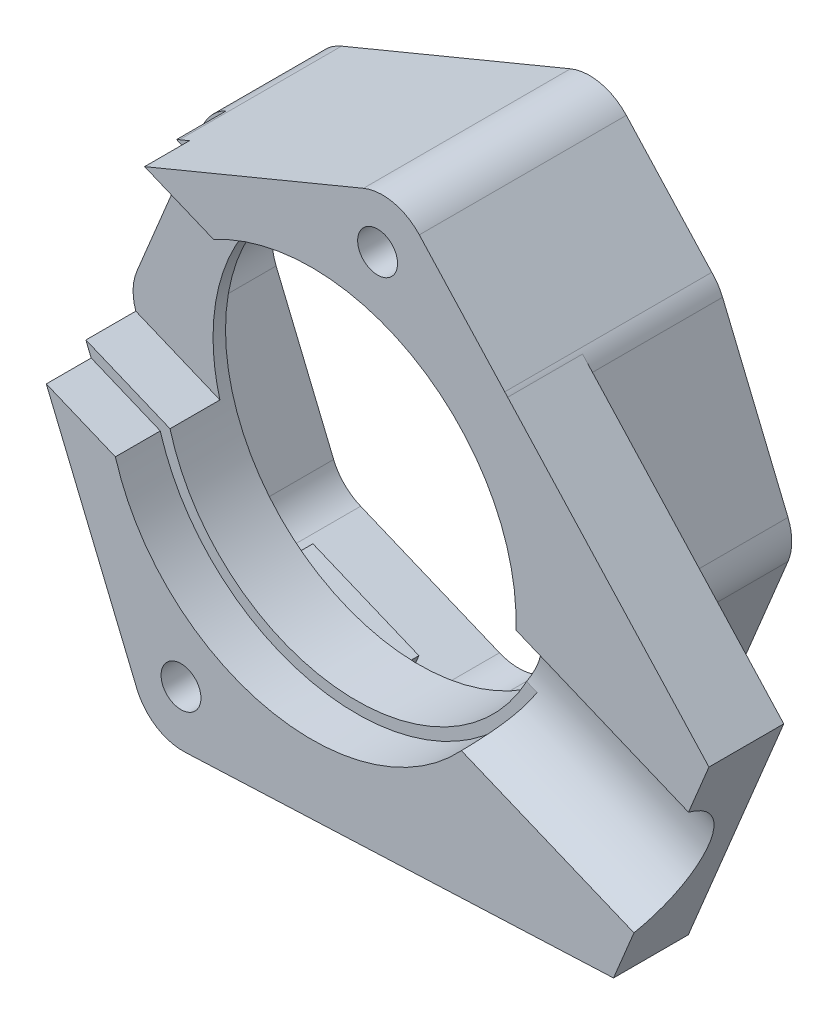
from build123d import *

# Parameters (mm, degrees)
BOSS_EXTRUDE1_DEPTH             = 6
BOSS_EXTRUDE1_2_DEPTH           = 6
CUT_EXTRUDE1_DEPTH              = 4
BOSS_EXTRUDE2_DEPTH             = 0.5
BOSS_EXTRUDE2_DEPTH_BACK        = 2
BOSS_EXTRUDE3_REACH             = 22.017
BOSS_EXTRUDE3_START             = -3
SKETCH6_R                       = 7.75
CUT_EXTRUDE2_DEPTH              = 17.227295759
FILLET1_R                       = 2
BOSS_EXTRUDE4_START             = 1.8
BOSS_EXTRUDE4_DEPTH             = 1.8
CUT_EXTRUDE3_DEPTH              = 2
BOSS_EXTRUDE5_DEPTH             = 3
CUT_EXTRUDE4_REACH              = 33.204
CUT_EXTRUDE4_END_RADIUS         = 7.75
SKETCH11_R                      = 3.1
BOSS_EXTRUDE6_DEPTH             = 8.3
TAP_DRILL_FOR_M2X0_4_TAP1_D     = 1.6
TAP_DRILL_FOR_M2X0_4_TAP1_DEPTH = 5
TAP_DRILL_FOR_M2X0_4_TAP1_TIP   = 0.480688495
FILLET2_R                       = 0.5


with BuildPart() as part:
    # Sketch1 → Boss-Extrude1 (new body)
    with BuildSketch(Plane.XY):
        Polygon((-8.605017992, 0), (-6.084666575, 6.084666575), (0, 8.605017992), (6.084666575, 6.084666575), (8.605017992, 0), (6.084666575, -6.084666575), (0, -8.605017992), (-6.084666575, -6.084666575), align=None)
    extrude(amount=BOSS_EXTRUDE1_DEPTH)

    # Sketch3 → Cut-Extrude1 (cut)
    with BuildSketch(Plane(origin=(0, 0, 0), x_dir=(-1, 0, 0), z_dir=(0, 0, -1))):
        Polygon((6.084666575, 6.084666575), (0, 8.605017992), (-6.084666575, 6.084666575), (-8.605017992, 0), (-6.084666575, -6.084666575), (0, -8.605017992), (6.084666575, -6.084666575), (8.605017992, 0), align=None)
    extrude(amount=-CUT_EXTRUDE1_DEPTH, mode=Mode.SUBTRACT)



with BuildPart() as body_2:
    # Sketch1 → Boss-Extrude1 2 (new body)
    with BuildSketch(Plane.XY):
        Polygon((-11.120367073, 0), (-7.863286966, 7.863286966), (0, 11.120367073), (7.863286966, 7.863286966), (11.120367073, 0), (7.863286966, -7.863286966), (0, -11.120367073), (-7.863286966, -7.863286966), align=None)
        Polygon((-7.097920102, 7.097920102), (0, 10.037974872), (7.097920102, 7.097920102), (10.037974872, 0), (7.097920102, -7.097920102), (0, -10.037974872), (-7.097920102, -7.097920102), (-10.037974872, 0), align=None, mode=Mode.SUBTRACT)
    extrude(amount=BOSS_EXTRUDE1_2_DEPTH)


with BuildPart() as part_1:
    add(part.part)

    add(body_2.part)  # Boss-Extrude2 merges body 2
    # Sketch4 → Boss-Extrude2 (add, two sides: drawn at the far end of the back side and taken through both)
    with BuildSketch(Plane.XY.offset(6).offset(-BOSS_EXTRUDE2_DEPTH_BACK)):
        Polygon((-11.120367073, 0), (-7.863286966, -7.863286966), (0, -11.120367073), (7.863286966, -7.863286966), (11.120367073, 0), (7.863286966, 7.863286966), (0, 11.120367073), (-7.863286966, 7.863286966), align=None)
    extrude(amount=BOSS_EXTRUDE2_DEPTH + BOSS_EXTRUDE2_DEPTH_BACK)

    # Sketch5 → Boss-Extrude3 (add, up to next)
    with BuildSketch(Plane(origin=(0, 0, 0), x_dir=(-1, 0, 0), z_dir=(0, 0, -1)).offset(BOSS_EXTRUDE3_START), mode=Mode.PRIVATE) as boss_extrude3_sk1:
        Polygon((-7.691079422, 5.665906826), (-9.451423211, 1.416060977), (-8.435155725, 0.995109201), (-6.674811936, 5.244955051), align=None)
    boss_extrude3_tool1 = extrude(boss_extrude3_sk1.sketch, amount=-BOSS_EXTRUDE3_REACH, mode=Mode.PRIVATE) - part_1.part
    # Sketch5 → Boss-Extrude3 (add, up to next)
    with BuildSketch(Plane(origin=(0, 0, 0), x_dir=(-1, 0, 0), z_dir=(0, 0, -1)).offset(BOSS_EXTRUDE3_START), mode=Mode.PRIVATE) as boss_extrude3_sk2:
        Polygon((1.416060977, -9.451423211), (5.665906826, -7.691079422), (5.244955051, -6.674811936), (0.995109201, -8.435155725), align=None)
    boss_extrude3_tool2 = extrude(boss_extrude3_sk2.sketch, amount=-BOSS_EXTRUDE3_REACH, mode=Mode.PRIVATE) - part_1.part
    add(boss_extrude3_tool1.solids().sort_by_distance((8.063118, 3.330508, 3))[0])
    add(boss_extrude3_tool2.solids().sort_by_distance((-3.330508, -8.063118, 3))[0])

    # Sketch6 → Cut-Extrude2 (cut, through all)
    with BuildSketch(Plane(origin=(0, 0, 4), x_dir=(-1, 0, 0), z_dir=(0, 0, -1))):
        Circle(SKETCH6_R)
    extrude(amount=-CUT_EXTRUDE2_DEPTH, mode=Mode.SUBTRACT)

    # Fillet1
    fillet1_edges = [part_1.edges().sort_by_distance(p)[0] for p in [
        (-7.863286966, -7.863286966, 3.25),
        (0, -11.120367073, 3.25),
        (7.863286966, -7.863286966, 3.25),
        (11.120367073, 0, 3.25),
        (7.863286966, 7.863286966, 3.25),
        (0, 11.120367073, 3.25),
        (-7.863286966, 7.863286966, 3.25),
        (-11.120367073, 0, 3.25),
        (7.097920102, 7.097920102, 2),
        (0, 10.037974872, 2),
        (10.037974872, 0, 2),
        (7.097920102, -7.097920102, 2),
        (0, -10.037974872, 2),
        (-7.097920102, -7.097920102, 2),
        (-10.037974872, 0, 2),
        (-7.097920102, 7.097920102, 2),
    ]]
    fillet(fillet1_edges, radius=FILLET1_R)

    # Sketch9 → Boss-Extrude4 (add)
    with BuildSketch(Plane.XY.offset(6.5).offset(BOSS_EXTRUDE4_START)):
        with BuildLine():
            ThreePointArc((8.180312302, 7.097920102), (7.746766799, 7.746766799), (7.097920102, 8.180312302))
            Line((7.097920102, 8.180312302), (0.765366865, 10.803341737))
            ThreePointArc((0.765366865, 10.803341737), (0, 10.955582672), (-0.765366865, 10.803341737))
            Line((-0.765366865, 10.803341737), (-6.694671234, 8.347343452))
            Line((-6.694671234, 8.347343452), (-3.924480161, 7.19989274))
            ThreePointArc((-3.924480161, 7.19989274), (7.575812167, -3.138004145), (-7.866119515, -2.316066445))
            Line((-7.866119515, -2.316066445), (-10.636310587, -1.168615733))
            Line((-10.636310587, -1.168615733), (-8.180312302, -7.097920102))
            ThreePointArc((-8.180312302, -7.097920102), (-7.746766799, -7.746766799), (-7.097920102, -8.180312302))
            Line((-7.097920102, -8.180312302), (-0.765366865, -10.803341737))
            ThreePointArc((-0.765366865, -10.803341737), (0, -10.955582672), (0.765366865, -10.803341737))
            Line((0.765366865, -10.803341737), (7.097920102, -8.180312302))
            ThreePointArc((7.097920102, -8.180312302), (7.746766799, -7.746766799), (8.180312302, -7.097920102))
            Line((8.180312302, -7.097920102), (10.803341737, -0.765366865))
            ThreePointArc((10.803341737, -0.765366865), (10.955582672, 0), (10.803341737, 0.765366865))
            Line((10.803341737, 0.765366865), (8.180312302, 7.097920102))
        make_face()
    extrude(amount=-BOSS_EXTRUDE4_DEPTH)

    # Sketch10 → Cut-Extrude3 (cut)
    with BuildSketch(Plane.XY.offset(6.5)):
        Polygon((-8.848789177, 8.806651439), (-3.151903136, 6.446923978), (-6.787395744, -2.329931581), (-12.484281785, 0.02979588), align=None)
    extrude(amount=-CUT_EXTRUDE3_DEPTH, mode=Mode.SUBTRACT)

    # Sketch12 → Boss-Extrude5 (add)
    with BuildSketch(Plane.XY.offset(8.3)):
        with BuildLine():
            Line((0, -10.955582672), (12.107294918, -10.42696676))
            Line((12.107294918, -10.42696676), (15.934129241, -1.188171435))
            Line((15.934129241, -1.188171435), (7.746766799, 7.746766799))
            Line((7.746766799, 7.746766799), (7.287962899, 6.639116202))
            Line((7.287962899, 6.639116202), (9.879462205, 0.382683432))
            ThreePointArc((9.879462205, 0.382683432), (9.955582672, 0), (9.879462205, -0.382683432))
            Line((9.879462205, -0.382683432), (7.256432769, -6.715236669))
            ThreePointArc((7.256432769, -6.715236669), (7.039660018, -7.039660018), (6.715236669, -7.256432769))
            Line((6.715236669, -7.256432769), (0.4588039, -9.847932075))
            Line((0.4588039, -9.847932075), (0, -10.955582672))
        make_face()
    extrude(amount=-BOSS_EXTRUDE5_DEPTH)

    # Cut-Extrude4: up to this cylinder (the profile starts outside it)
    cut_extrude4_end = Plane(origin=(0, 0, 9.5), z_dir=(0, 0, -1)) * Cylinder(CUT_EXTRUDE4_END_RADIUS, 82.908, mode=Mode.PRIVATE)
    # Sketch11 → Cut-Extrude4 (cut, up to the surface)
    with BuildSketch(Plane(origin=(14.020712079, -5.807569097, 0), x_dir=(0, 0, -1), z_dir=(0.9238795325112878, -0.38268343236508723, 0)), mode=Mode.PRIVATE) as cut_extrude4_sk1:
        with Locations((-9.5, 0)):
            Circle(SKETCH11_R)
    cut_extrude4_tool1 = extrude(cut_extrude4_sk1.sketch, amount=-CUT_EXTRUDE4_REACH, mode=Mode.PRIVATE) - cut_extrude4_end
    add(cut_extrude4_tool1.solids().sort_by_distance((14.020712, -5.807569, 9.5))[0], mode=Mode.SUBTRACT)

    # Sketch13 → Boss-Extrude6 (add)
    with BuildSketch(Plane.XY.offset(8.3)):
        with BuildLine():
            Line((-8.180312302, -7.097920102), (-7.001403735, -9.944057152))
            ThreePointArc((-7.001403735, -9.944057152), (-6.228243887, -10.865473179), (-5.066405895, -11.176786731))
            Line((-5.066405895, -11.176786731), (0.174311485, -10.947972068))
            Line((0.174311485, -10.947972068), (-8.180312302, -7.097920102))
        make_face()
        with BuildLine():
            Line((7.864642123, 7.618128456), (4.320691724, 11.485671654))
            ThreePointArc((4.320691724, 11.485671654), (3.279016278, 12.087083253), (2.080770186, 11.982250304))
            Line((2.080770186, 11.982250304), (-0.765366865, 10.803341737))
            Line((-0.765366865, 10.803341737), (7.864642123, 7.618128456))
        make_face()
    extrude(amount=-BOSS_EXTRUDE6_DEPTH)

    # Tap Drill for M2x0.4 Tap1
    with Locations(Plane.XY.offset(8.3)):
        with Locations((-5.235070699, -8.98020238), (2.648208008, 10.05171599)):
            Hole(TAP_DRILL_FOR_M2X0_4_TAP1_D / 2, depth=TAP_DRILL_FOR_M2X0_4_TAP1_DEPTH)
            with Locations((0, 0, -(TAP_DRILL_FOR_M2X0_4_TAP1_DEPTH + TAP_DRILL_FOR_M2X0_4_TAP1_TIP / 2))):  # 118° drill point
                Cone(0, TAP_DRILL_FOR_M2X0_4_TAP1_D / 2, TAP_DRILL_FOR_M2X0_4_TAP1_TIP, mode=Mode.SUBTRACT)

    # Fillet2
    fillet2_edges = [part_1.edges().sort_by_distance(p)[0] for p in [
        (9.451423211, 1.416060977, 3.5),
        (7.691079422, 5.665906826, 3.5),
        (-5.665906826, -7.691079422, 3.5),
        (-1.416060977, -9.451423211, 3.5),
    ]]
    fillet(fillet2_edges, radius=FILLET2_R)


solid = part_1.part
